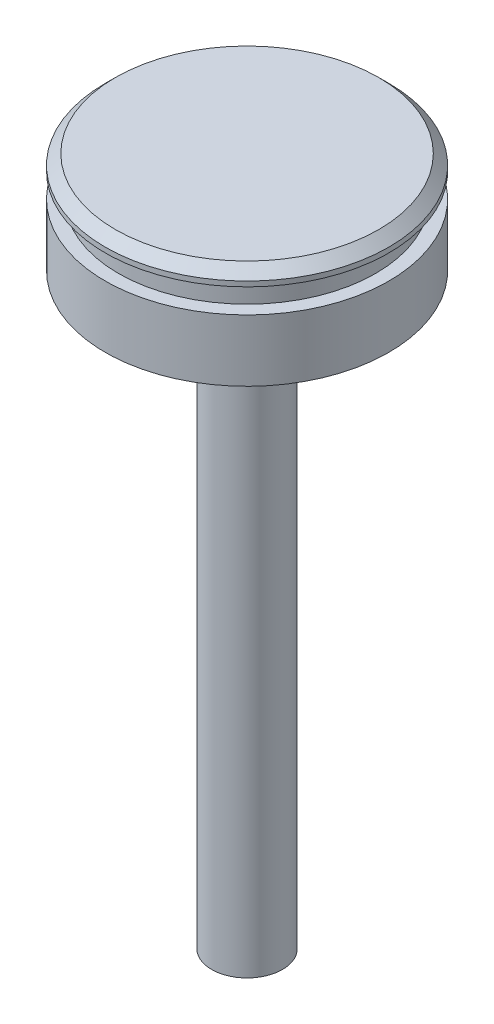
from build123d import *

# Parameters (mm, degrees)
SMUSSO1_SIZE = 1


with BuildPart() as part:
    # Schizzo1 → Rivoluzione1 (revolve)
    with BuildSketch(Plane.XY, mode=Mode.PRIVATE) as rivoluzione1_sk:
        Polygon((-3.5, 0), (0, 0), (0, 68), (-14, 68), (-14, 66.5), (-12.7, 66.5), (-12.7, 64.1), (-14, 64.1), (-14, 58), (-3.5, 58), align=None)
    revolve(rivoluzione1_sk.sketch.rotate(Axis((0, 0, 0), (0, 1, 0)), 270), axis=Axis((0, 0, 0), (0, 1, 0)))

    # Smusso1
    smusso1_edges = [part.edges().sort_by_distance(p)[0] for p in [
        (0, 68, 14),
    ]]
    chamfer(smusso1_edges, length=SMUSSO1_SIZE)


solid = part.part
